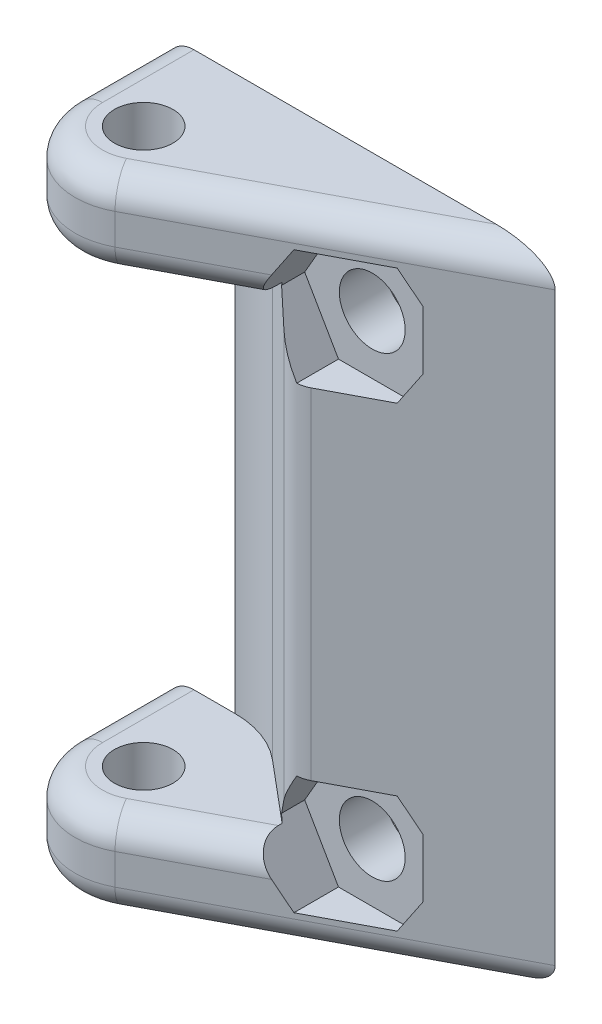
from build123d import *

# Parameters (mm, degrees)
SKETCH1_R           = 2.032
BOSS_EXTRUDE1_DEPTH = 22.225
CUT_EXTRUDE4_DEPTH  = 16.271875
SKETCH13_R          = 2.286
CUT_EXTRUDE9_DEPTH  = 34.3375
CUT_EXTRUDE10_START = -3.175
CUT_EXTRUDE10_DEPTH = 31.1625
FILLET1_R           = 1.905


with BuildPart() as part:
    # Sketch1 → Boss-Extrude1 (new, symmetric)
    with BuildSketch(Plane(origin=(0, 0, 0), x_dir=(1, 0, 0), z_dir=(0, 1, 0))):
        with BuildLine():
            Line((-4.7625, 6.35), (-4.7625, 0))
            ThreePointArc((-4.7625, 0), (-2.458714709, -4.07874101), (2.223800568, -4.211426989))
            Line((2.223800568, -4.211426989), (22.225, 6.35))
            Line((22.225, 6.35), (-4.7625, 6.35))
        make_face()
        with Locations(Location((0, 0, 0), (0, 0, 270))):
            Circle(SKETCH1_R, mode=Mode.SUBTRACT)
    extrude(amount=BOSS_EXTRUDE1_DEPTH, both=True)

    # Sketch6 → Cut-Extrude4 (cut, symmetric)
    with BuildSketch(Plane(origin=(0, 0, 0), x_dir=(1, 0, 0), z_dir=(0, 1, 0))):
        with BuildLine():
            Line((0, 6.35), (-4.7625, 6.35))
            Line((-4.7625, 6.35), (-4.7625, 0))
            ThreePointArc((-4.7625, 0), (-2.458714709, -4.07874101), (2.223800568, -4.211426989))
            Line((2.223800568, -4.211426989), (10.002651587, -0.10388497))
            Line((10.002651587, -0.10388497), (4.081701322, 4.864382214))
            ThreePointArc((4.081701322, 4.864382214), (2.17182791, 5.967048142), (0, 6.35))
        make_face()
    extrude(amount=CUT_EXTRUDE4_DEPTH, both=True, mode=Mode.SUBTRACT)

    # Sketch13 → Cut-Extrude9 (cut, through all)
    with BuildSketch(Plane(origin=(0, 0, -6.35), x_dir=(-1, 0, 0), z_dir=(0, 0, -1))):
        with Locations((-12.7, 15.875)):
            Circle(SKETCH13_R)
        with Locations((-12.7, -15.875)):
            Circle(SKETCH13_R)
    extrude(amount=-CUT_EXTRUDE9_DEPTH, mode=Mode.SUBTRACT)

    # Sketch14 → Cut-Extrude10 (cut, through all)
    with BuildSketch(Plane(origin=(0, 0, -6.35), x_dir=(-1, 0, 0), z_dir=(0, 0, -1)).offset(CUT_EXTRUDE10_START)):
        Polygon((-10.353648506, 19.939), (-15.046351494, 19.939), (-17.392702988, 15.875), (-15.046351494, 11.811), (-10.353648506, 11.811), (-8.007297012, 15.875), align=None)
        Polygon((-8.007297012, -15.875), (-10.353648506, -11.811), (-15.046351494, -11.811), (-17.392702988, -15.875), (-15.046351494, -19.939), (-10.353648506, -19.939), align=None)
    extrude(amount=-CUT_EXTRUDE10_DEPTH, mode=Mode.SUBTRACT)

    # Fillet1
    fillet1_edges = [part.edges().sort_by_distance(p)[0] for p in [
        (-4.7625, -22.225, -3.175),
        (-2.458714709, -22.225, 4.07874101),
        (12.224400284, 22.225, -1.069286506),
        (-2.458714709, 22.225, 4.07874101),
        (12.224400284, -22.225, -1.069286506),
        (-4.7625, 22.225, -3.175),
        (-4.7625, -16.271875, -3.175),
        (5.230116734, -16.271875, 2.623972756),
        (-4.7625, 16.271875, -3.175),
        (-2.458714709, 16.271875, 4.07874101),
        (-2.458714709, -16.271875, 4.07874101),
        (5.230116734, 16.271875, 2.623972756),
        (10.002651587, 0, 0.10388497),
    ]]
    fillet(fillet1_edges, radius=FILLET1_R)


solid = part.part
